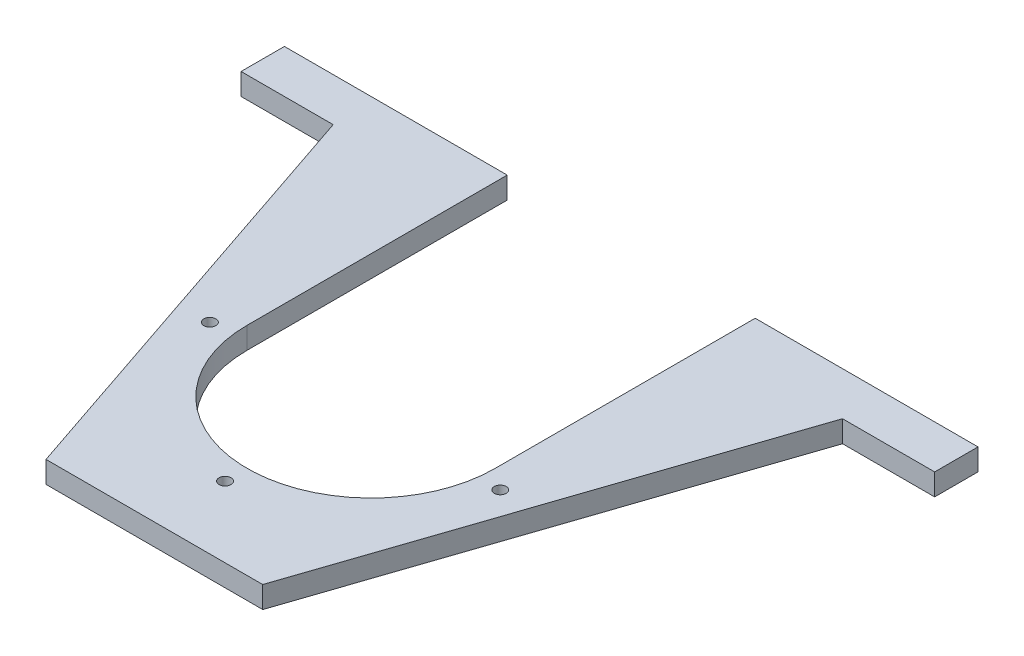
from build123d import *

# Parameters (mm, degrees)
BOSS_EXTRU_1_DEPTH      = 6.35
ESQUISSE3_R             = 36.322
ENL_V_MAT_EXTRU_2_DEPTH = 173.855351378
ENL_V_MAT_EXTRU_5_DEPTH = 6.35
ESQUISSE7_R             = 1.75
ENL_V_MAT_EXTRU_6_DEPTH = 6.35


with BuildPart() as part:
    # Esquisse1 → Boss.-Extru.1 (new body)
    with BuildSketch(Plane(origin=(0, 0, 0), x_dir=(1, 0, 0), z_dir=(0, 1, 0))):
        Polygon((-101.6, 139.7), (-101.6, 127), (-74.6125, 127), (-31.75, 0), (31.75, 0), (74.6125, 127), (101.6, 127), (101.6, 139.7), align=None)
    extrude(amount=BOSS_EXTRU_1_DEPTH)

    # Esquisse3 → Enlèv. mat.-Extru.2 (cut, through all)
    with BuildSketch(Plane(origin=(0, 6.35, 0), x_dir=(1, 0, 0), z_dir=(0, 1, 0))):
        with Locations(Location((0, 63.5, 0), (0, 0, 270))):
            Circle(ESQUISSE3_R)
    extrude(amount=-ENL_V_MAT_EXTRU_2_DEPTH, mode=Mode.SUBTRACT)

    # Esquisse6 → Enlèv. mat.-Extru.5 (cut)
    with BuildSketch(Plane(origin=(0, 6.35, 0), x_dir=(1, 0, 0), z_dir=(0, 1, 0))):
        with BuildLine():
            Line((-36.322, 63.5), (-36.322, 139.7))
            Line((-36.322, 139.7), (36.322, 139.7))
            Line((36.322, 139.7), (36.322, 63.5))
            ThreePointArc((36.322, 63.5), (0, 99.822), (-36.322, 63.5))
        make_face()
    extrude(amount=-ENL_V_MAT_EXTRU_5_DEPTH, mode=Mode.SUBTRACT)

    # Esquisse7 → Enlèv. mat.-Extru.6 (cut)
    with BuildSketch(Plane(origin=(0, 6.35, 0), x_dir=(1, 0, 0), z_dir=(0, 1, 0))):
        with Locations(Location((0, 20.701, 0), (0, 0, 270))):
            Circle(ESQUISSE7_R)
        with Locations(Location((42.54026093, 58.801, 0), (0, 0, 270))):
            Circle(ESQUISSE7_R)
        with Locations(Location((-42.54026093, 58.801, 0), (0, 0, 270))):
            Circle(ESQUISSE7_R)
    extrude(amount=-ENL_V_MAT_EXTRU_6_DEPTH, mode=Mode.SUBTRACT)


solid = part.part
